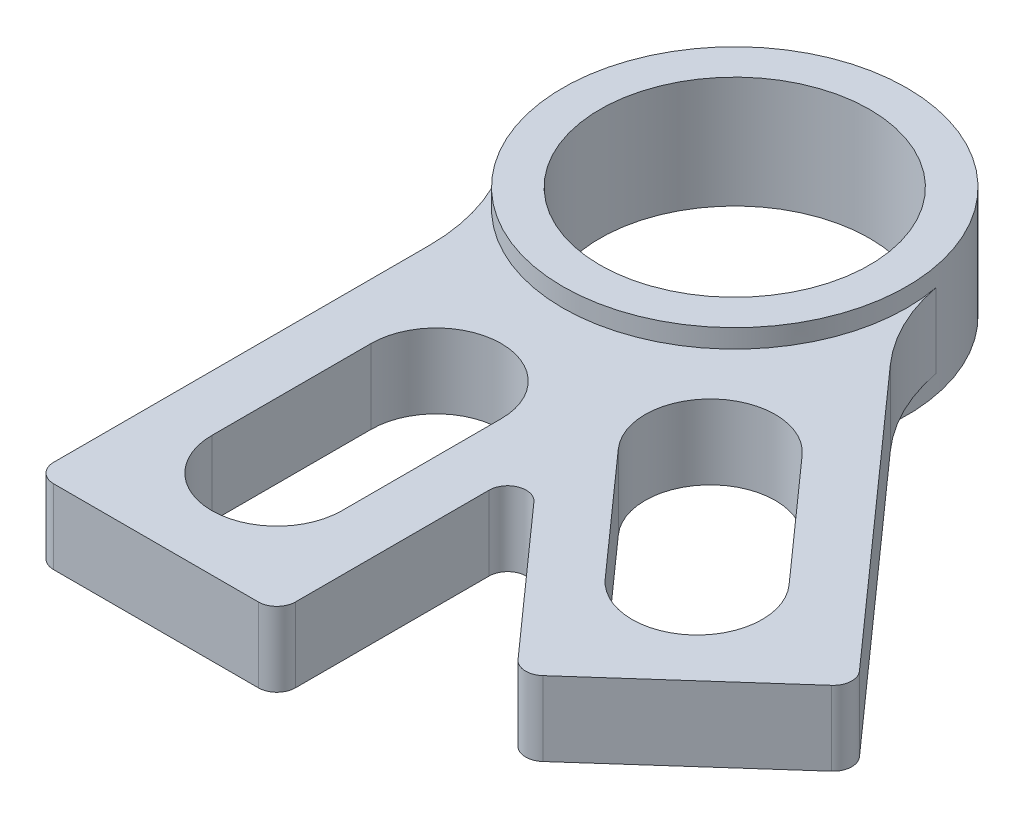
from build123d import *

# Parameters (mm, degrees)
SKETCH1_R                      = 14.6812
SKETCH1_R_2                    = 11.5062
BEARING_INSERT_EXTRUDE_DEPTH   = 4.7625
APEX_SLOT_INSERT_EXTRUDE_DEPTH = 3.175
FILLET1_R                      = 16.002
FILLET2_R                      = 1.5875


with BuildPart() as part:
    # Sketch1 → Bearing_Insert_Extrude (new, symmetric)
    with BuildSketch(Plane(origin=(0, 0, 0), x_dir=(1, 0, 0), z_dir=(0, 1, 0))):
        with Locations(Location((0, 0, 0), (0, 0, 90))):
            Circle(SKETCH1_R)
        with Locations(Location((0, 0, 0), (0, 0, 90))):
            Circle(SKETCH1_R_2, mode=Mode.SUBTRACT)
    extrude(amount=BEARING_INSERT_EXTRUDE_DEPTH, both=True)

    # Sketch1<4> → Apex_Slot_Insert_Extrude (add, symmetric)
    with BuildSketch(Plane(origin=(0, 0, 0), x_dir=(1, 0, 0), z_dir=(0, 1, 0))):
        with BuildLine():
            Line((-10.31875, -10.443228997), (-10.31875, -49.3903))
            Line((-10.31875, -49.3903), (10.31875, -49.3903))
            Line((10.31875, -49.3903), (10.31875, -27.114771747))
            Line((10.31875, -27.114771747), (25.128243321, -43.754425185))
            Line((25.128243321, -43.754425185), (40.544301873, -30.033946149))
            Line((40.544301873, -30.033946149), (14.651026466, -0.94077464))
            ThreePointArc((14.651026466, -0.94077464), (5.221715671, -13.721199616), (-10.31875, -10.443228997))
        make_face()
        with BuildLine():
            ThreePointArc((5.55625, -39.07155), (0, -44.6278), (-5.55625, -39.07155))
            Line((-5.55625, -39.07155), (-5.55625, -25.48255))
            ThreePointArc((-5.55625, -25.48255), (0, -19.9263), (5.55625, -25.48255))
            Line((5.55625, -25.48255), (5.55625, -39.07155))
        make_face(mode=Mode.SUBTRACT)
        with BuildLine():
            ThreePointArc((30.126510381, -25.492181266), (29.670008204, -33.336633694), (21.825555776, -32.880131516))
            Line((21.825555776, -32.880131516), (12.791148042, -22.729249885))
            ThreePointArc((12.791148042, -22.729249885), (13.24765022, -14.884797457), (21.092102647, -15.341299635))
            Line((21.092102647, -15.341299635), (30.126510381, -25.492181266))
        make_face(mode=Mode.SUBTRACT)
    extrude(amount=APEX_SLOT_INSERT_EXTRUDE_DEPTH, both=True)

    # Fillet1
    fillet1_edges = [part.edges().sort_by_distance(p)[0] for p in [
        (14.651026466, 0, 0.94077464),
        (-10.31875, 0, 10.443228997),
    ]]
    fillet(fillet1_edges, radius=FILLET1_R)

    # Fillet2
    fillet2_edges = [part.edges().sort_by_distance(p)[0] for p in [
        (-10.31875, 0, 49.3903),
        (10.31875, 0, 49.3903),
        (10.31875, 0, 27.114771747),
        (25.128243321, 0, 43.754425185),
        (40.544301873, 0, 30.033946149),
    ]]
    fillet(fillet2_edges, radius=FILLET2_R)


solid = part.part
